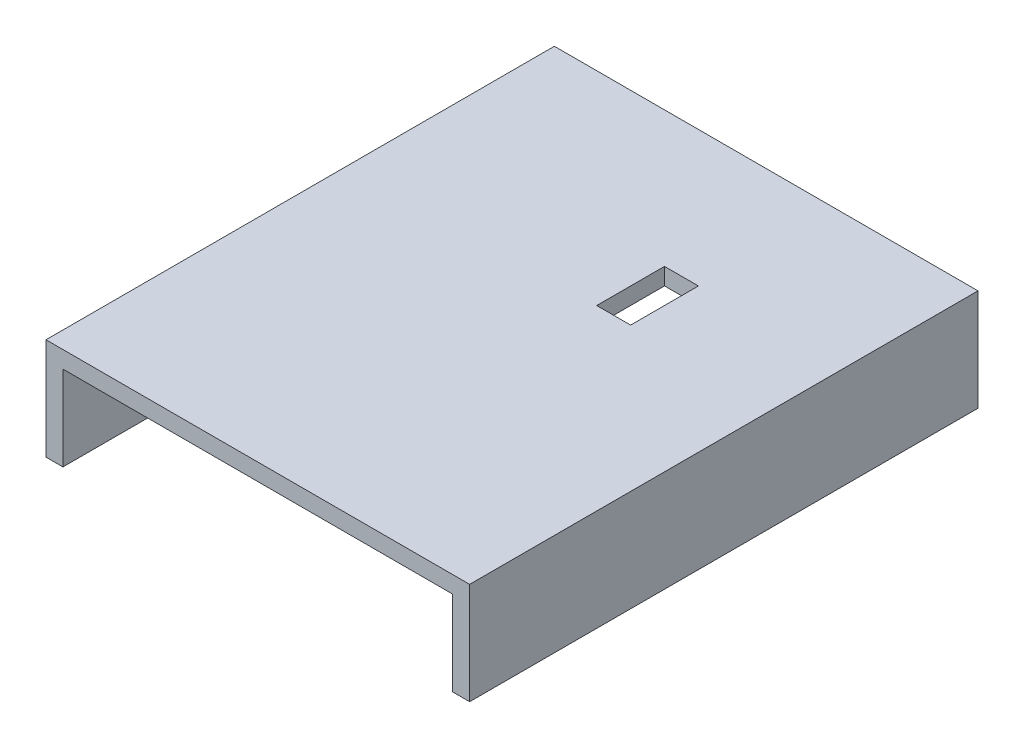
from build123d import *

# Parameters (mm, degrees)
SKETCH1_W           = 250
SKETCH1_H           = 300
SKETCH1_W_2         = 20
SKETCH1_H_2         = 40
BOSS_EXTRUDE1_DEPTH = 10
SKETCH2_W           = 10
SKETCH2_H           = 300
BOSS_EXTRUDE2_DEPTH = 50


with BuildPart() as part:
    # Sketch1 → Boss-Extrude1 (new body)
    with BuildSketch(Plane(origin=(0, 0, 0), x_dir=(1, 0, 0), z_dir=(0, 1, 0))):
        Rectangle(SKETCH1_W, SKETCH1_H)
        with Locations((30, 50)):
            Rectangle(SKETCH1_W_2, SKETCH1_H_2, mode=Mode.SUBTRACT)
    extrude(amount=BOSS_EXTRUDE1_DEPTH)

    # Sketch2 → Boss-Extrude2 (add)
    with BuildSketch(Plane.XZ):
        with Locations((120, 0)):
            Rectangle(SKETCH2_W, SKETCH2_H)
        with Locations((-120, 0)):
            Rectangle(SKETCH2_W, SKETCH2_H)
    extrude(amount=BOSS_EXTRUDE2_DEPTH)


solid = part.part
